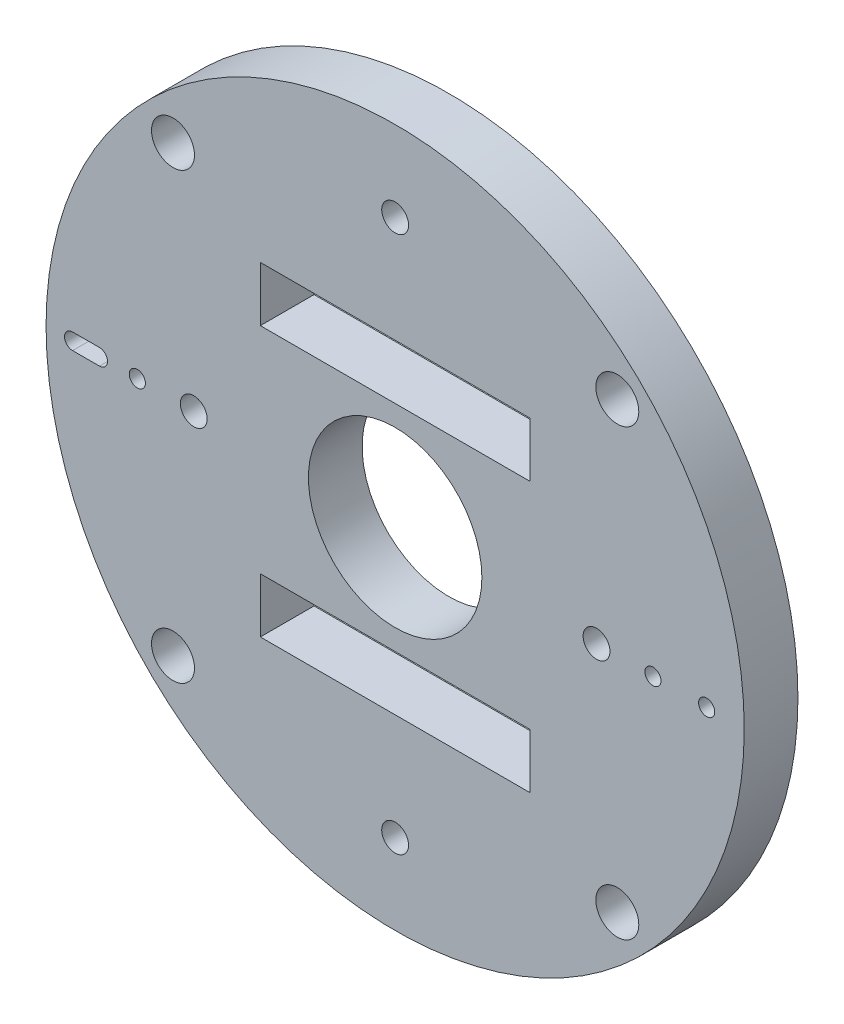
from build123d import *

# Parameters (mm, degrees)
SKETCH1_R           = 65
SKETCH1_R_2         = 2.5
SKETCH1_R_3         = 16.15
SKETCH1_R_4         = 4
SKETCH1_R_5         = 1.5
SKETCH1_W           = 50.2
SKETCH1_H           = 10.2
BOSS_EXTRUDE1_DEPTH = 10


with BuildPart() as part:
    # Sketch1 → Boss-Extrude1 (new body)
    with BuildSketch(Plane.XY):
        Circle(SKETCH1_R)
        with Locations((-37.5, 0)):
            Circle(SKETCH1_R_2, mode=Mode.SUBTRACT)
        with Locations((37.5, 0)):
            Circle(SKETCH1_R_2, mode=Mode.SUBTRACT)
        with Locations((0, 50)):
            Circle(SKETCH1_R_2, mode=Mode.SUBTRACT)
        with Locations((0, -50)):
            Circle(SKETCH1_R_2, mode=Mode.SUBTRACT)
        Circle(SKETCH1_R_3, mode=Mode.SUBTRACT)
        with Locations((-41.365746699, 41.365746699)):
            Circle(SKETCH1_R_4, mode=Mode.SUBTRACT)
        with Locations((41.365746699, -41.365746699)):
            Circle(SKETCH1_R_4, mode=Mode.SUBTRACT)
        with Locations((41.365746699, 41.365746699)):
            Circle(SKETCH1_R_4, mode=Mode.SUBTRACT)
        with Locations((-41.365746699, -41.365746699)):
            Circle(SKETCH1_R_4, mode=Mode.SUBTRACT)
        with Locations((48, 0)):
            Circle(SKETCH1_R_5, mode=Mode.SUBTRACT)
        with Locations((58, 0)):
            Circle(SKETCH1_R_5, mode=Mode.SUBTRACT)
        with Locations((-48, 0)):
            Circle(SKETCH1_R_5, mode=Mode.SUBTRACT)
        with Locations((0, -25.1)):
            Rectangle(SKETCH1_W, SKETCH1_H, mode=Mode.SUBTRACT)
        with BuildLine():
            Line((-55.056563459, -1.5), (-60.056563459, -1.5))
            ThreePointArc((-60.056563459, -1.5), (-61.556563459, 0), (-60.056563459, 1.5))
            Line((-60.056563459, 1.5), (-55.056563459, 1.5))
            ThreePointArc((-55.056563459, 1.5), (-53.556563459, 0), (-55.056563459, -1.5))
        make_face(mode=Mode.SUBTRACT)
        with Locations((0, 25.1)):
            Rectangle(SKETCH1_W, SKETCH1_H, mode=Mode.SUBTRACT)
    extrude(amount=BOSS_EXTRUDE1_DEPTH)


solid = part.part
